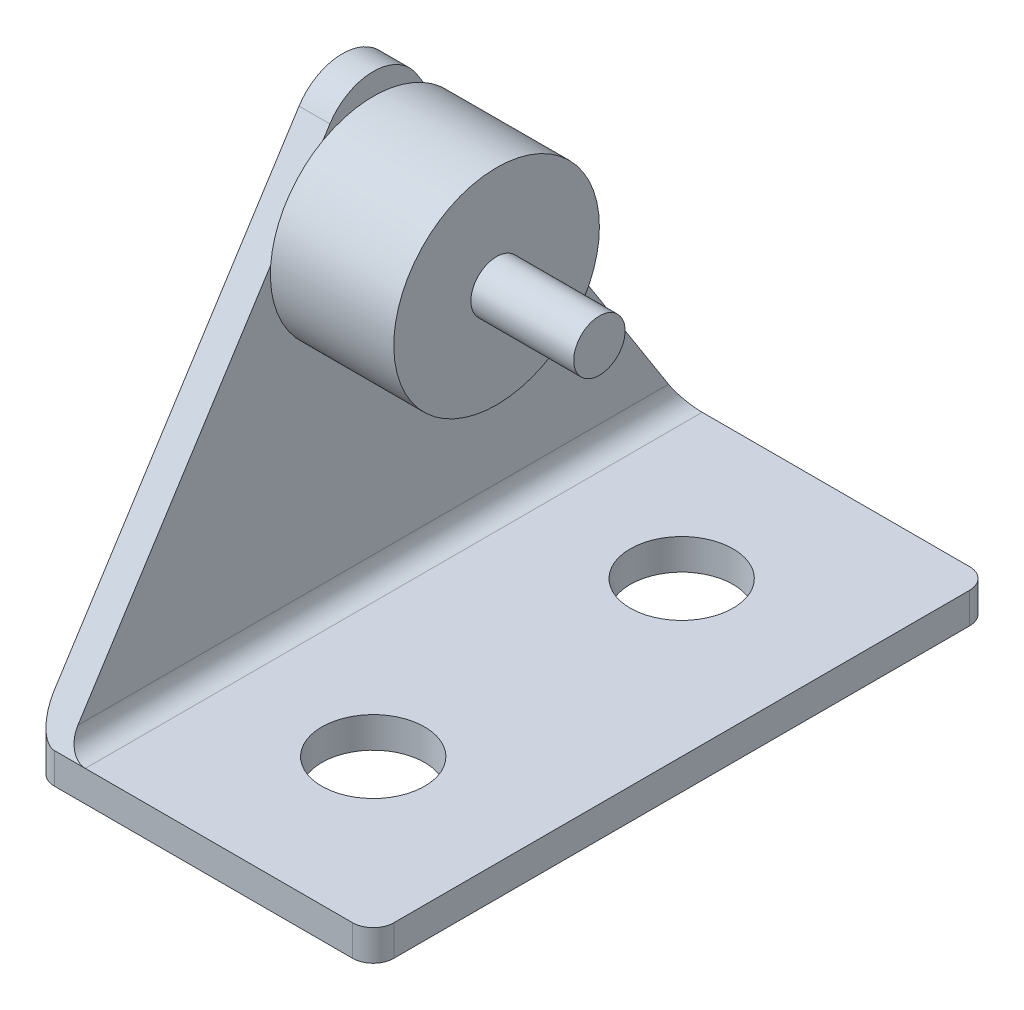
from build123d import *

# Parameters (mm, degrees)
BOSS_EXTRUDE1_DEPTH = 38.1
CUT_EXTRUDE2_DEPTH  = 76.2
FILLET1_R           = 6.35
SKETCH10_W          = 21.59
SKETCH10_H          = 76.2
CUT_EXTRUDE3_DEPTH  = 76.2
FILLET2_R           = 2.54
FILLET3_R           = 2.54
SKETCH11_R          = 6.5024
CUT_EXTRUDE4_DEPTH  = 76.2
SKETCH12_R          = 6.35
CUT_EXTRUDE5_DEPTH  = 76.2
SKETCH13_R          = 12.7
BOSS_EXTRUDE2_DEPTH = 15.24
CUT_EXTRUDE6_START  = -6.604
SKETCH17_R          = 6.5024
CUT_EXTRUDE6_DEPTH  = 6.604
SKETCH18_R          = 3.175
BOSS_EXTRUDE3_DEPTH = 12.7


with BuildPart() as part:
    # Sketch7 → Boss-Extrude1 (new, symmetric)
    with BuildSketch(Plane.XY):
        Polygon((0, 0), (0, 63.5), (3.81, 63.5), (3.81, 3.81), (63.5, 3.81), (63.5, 0), align=None)
    extrude(amount=BOSS_EXTRUDE1_DEPTH, both=True)

    # Sketch8 → Cut-Extrude2 (cut)
    with BuildSketch(Plane(origin=(3.81, 0, 0), x_dir=(0, 0, -1), z_dir=(1, 0, 0))):
        Polygon((-38.1, 63.5), (-38.1, 3.81), (0, 63.5), align=None)
        Polygon((38.1, 63.5), (0, 63.5), (38.1, 3.81), align=None)
    extrude(amount=-CUT_EXTRUDE2_DEPTH, mode=Mode.SUBTRACT)

    # Fillet1
    fillet1_edges = [part.edges().sort_by_distance(p)[0] for p in [
        (1.905, 63.5, 0),
    ]]
    fillet(fillet1_edges, radius=FILLET1_R)

    # Sketch10 → Cut-Extrude3 (cut)
    with BuildSketch(Plane(origin=(0, 3.81, 0), x_dir=(1, 0, 0), z_dir=(0, 1, 0))):
        with Locations((52.705, 0)):
            Rectangle(SKETCH10_W, SKETCH10_H)
    extrude(amount=-CUT_EXTRUDE3_DEPTH, mode=Mode.SUBTRACT)

    # Fillet2
    fillet2_edges = [part.edges().sort_by_distance(p)[0] for p in [
        (0, 1.905, 38.1),
        (0, 1.905, -38.1),
        (41.91, 1.905, -38.1),
        (41.91, 1.905, 38.1),
    ]]
    fillet(fillet2_edges, radius=FILLET2_R)

    # Fillet3
    fillet3_edges = [part.edges().sort_by_distance(p)[0] for p in [
        (3.81, 3.81, 0),
    ]]
    fillet(fillet3_edges, radius=FILLET3_R)

    # Sketch11 → Cut-Extrude4 (cut)
    with BuildSketch(Plane(origin=(3.81, 0, 0), x_dir=(0, 0, -1), z_dir=(1, 0, 0))):
        with Locations((0, 42.692021475)):
            Circle(SKETCH11_R)
    extrude(amount=-CUT_EXTRUDE4_DEPTH, mode=Mode.SUBTRACT)

    # Sketch12 → Cut-Extrude5 (cut)
    with BuildSketch(Plane(origin=(0, 3.81, 0), x_dir=(1, 0, 0), z_dir=(0, 1, 0))):
        with Locations(Location((22.86, 19.05, 0), (0, 0, 180))):
            Circle(SKETCH12_R)
        with Locations(Location((22.86, -19.05, 0), (0, 0, 180))):
            Circle(SKETCH12_R)
    extrude(amount=-CUT_EXTRUDE5_DEPTH, mode=Mode.SUBTRACT)

    # Sketch13 → Boss-Extrude2 (add)
    with BuildSketch(Plane(origin=(3.81, 0, 0), x_dir=(0, 0, -1), z_dir=(1, 0, 0))):
        with Locations(Location((0, 42.692021475, 0), (0, 0, 175.622523878))):
            Circle(SKETCH13_R)
    extrude(amount=BOSS_EXTRUDE2_DEPTH)

    # Sketch17 → Cut-Extrude6 (cut)
    with BuildSketch(Plane.ZY.offset(CUT_EXTRUDE6_START)):
        with Locations(Location((0, 42.692021475, 0), (0, 0, 180))):
            Circle(SKETCH17_R)
    extrude(amount=CUT_EXTRUDE6_DEPTH, mode=Mode.SUBTRACT)

    # Sketch18 → Boss-Extrude3 (add)
    with BuildSketch(Plane(origin=(19.05, 0, 0), x_dir=(0, 0, -1), z_dir=(1, 0, 0))):
        with Locations((0, 42.692021475)):
            Circle(SKETCH18_R)
    extrude(amount=BOSS_EXTRUDE3_DEPTH)


solid = part.part
